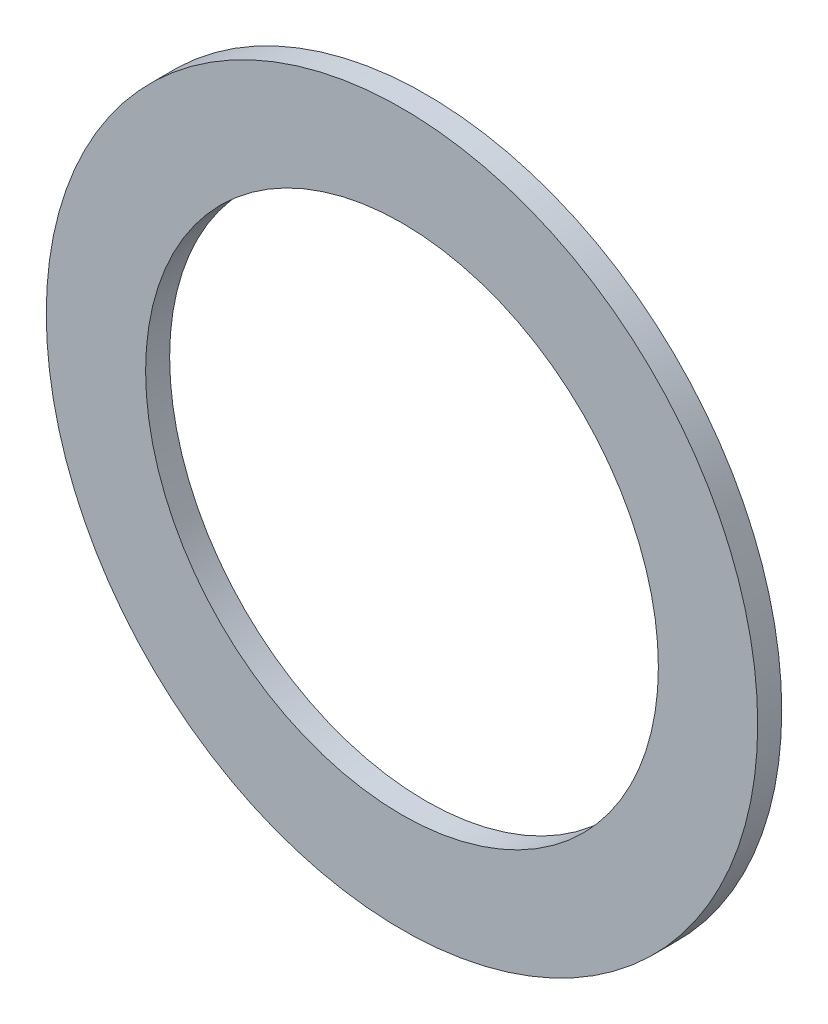
from build123d import *

# Parameters (mm, degrees)
STACK_WASHER_START = 20
SKETCH_1_R         = 22.2
SKETCH_1_R_2       = 16
STACK_WASHER_DEPTH = 1.5


with BuildPart() as part:
    # Эскиз1 → Stack_washer (new body)
    with BuildSketch(Plane.XY.offset(STACK_WASHER_START)):
        Circle(SKETCH_1_R)
        Circle(SKETCH_1_R_2, mode=Mode.SUBTRACT)
    extrude(amount=STACK_WASHER_DEPTH)


solid = part.part
